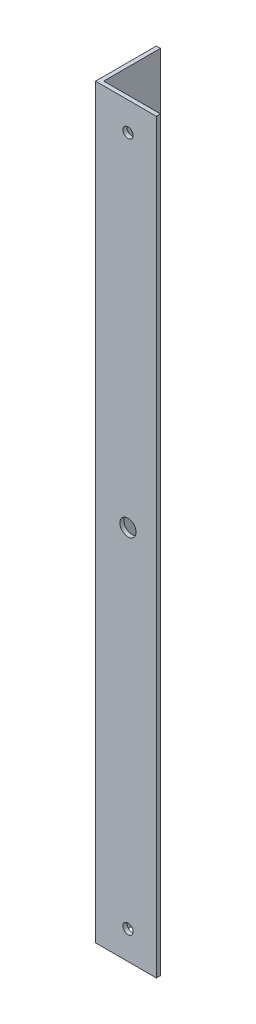
from build123d import *

# Parameters (mm, degrees)
SKETCH_1_W          = 15
SKETCH_1_H          = 1
EXTRUDE_1_DEPTH     = 184
SKETCH_3_W          = 1
SKETCH_3_H          = 184
EXTRUDE_2_DEPTH     = 14
M3X0_5_2_D          = 2.5
SKETCH_8_R          = 2
CUT_EXTRUDE_1_DEPTH = 10


with BuildPart() as part:
    # ｽｹｯﾁ1 → ﾎﾞｽ - 押し出し1 (new body)
    with BuildSketch(Plane(origin=(0, 0, 0), x_dir=(1, 0, 0), z_dir=(0, 1, 0))):
        with Locations((7.5, -0.5)):
            Rectangle(SKETCH_1_W, SKETCH_1_H)
    extrude(amount=EXTRUDE_1_DEPTH)

    # ｽｹｯﾁ3 → ﾎﾞｽ - 押し出し2 (add)
    with BuildSketch(Plane(origin=(0, 0, 0), x_dir=(-1, 0, 0), z_dir=(0, 0, -1))):
        with Locations((-0.5, 92)):
            Rectangle(SKETCH_3_W, SKETCH_3_H)
    extrude(amount=EXTRUDE_2_DEPTH)

    # M3x0.5 ねじ穴2 (through all)
    with Locations(Plane.XY.offset(1)):
        with Locations((8, 7), (8, 177)):
            Hole(M3X0_5_2_D / 2)

    # ｽｹｯﾁ8 → ｶｯﾄ - 押し出し1 (cut)
    with BuildSketch(Plane.XY.offset(1)):
        with Locations((8, 92.680160456)):
            Circle(SKETCH_8_R)
    extrude(amount=-CUT_EXTRUDE_1_DEPTH, mode=Mode.SUBTRACT)


solid = part.part
